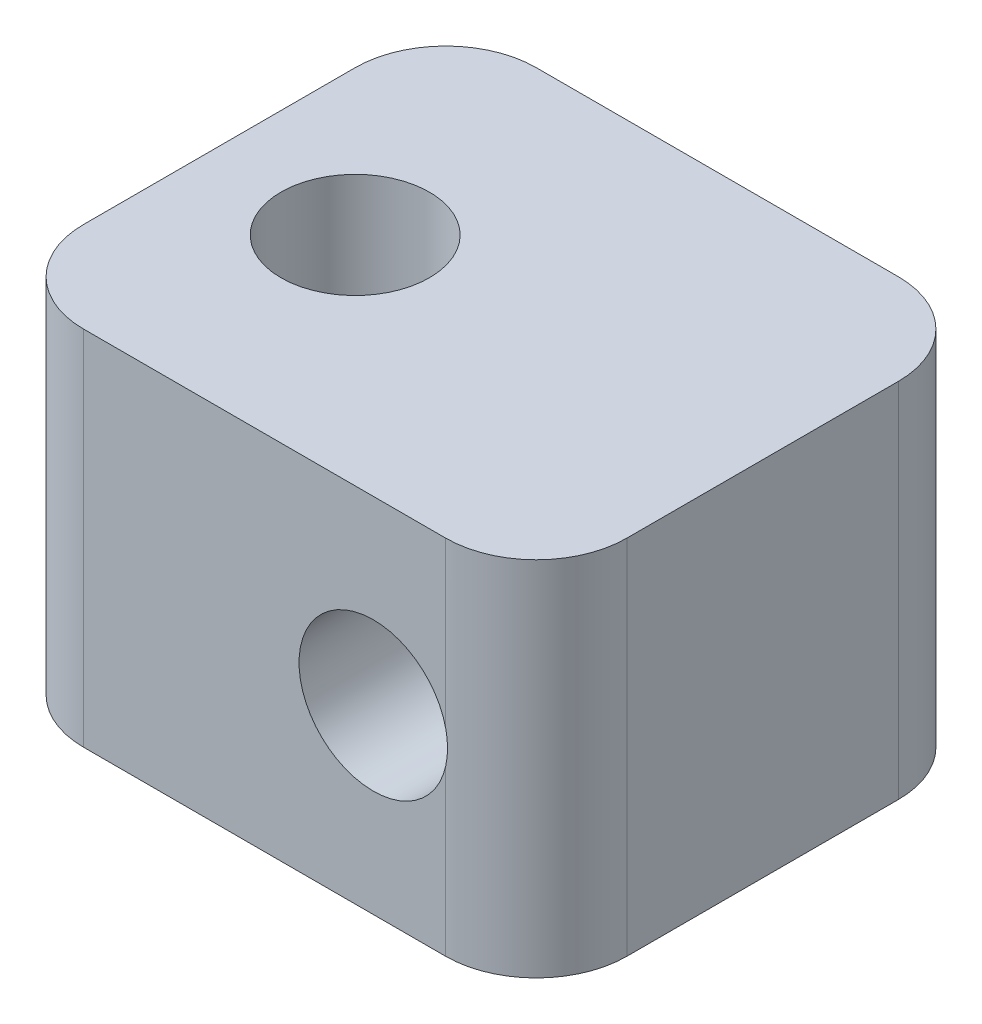
from build123d import *

# Parameters (mm, degrees)
SKETCH_1_W          = 30
SKETCH_1_H          = 20
EXTRUDE_1_DEPTH     = 25
SKETCH_2_R          = 4.1
CUT_EXTRUDE_1_DEPTH = 25
SKETCH_3_R          = 4.1
CUT_EXTRUDE_2_DEPTH = 25
FILLET_2_R          = 5


with BuildPart() as part:
    # 草图1 → 凸台-拉伸1 (new body)
    with BuildSketch(Plane.XY):
        Rectangle(SKETCH_1_W, SKETCH_1_H)
    extrude(amount=EXTRUDE_1_DEPTH)

    # 草图2 → 切除-拉伸1 (cut)
    with BuildSketch(Plane.XY.offset(25)):
        with Locations((6, 0)):
            Circle(SKETCH_2_R)
    extrude(amount=-CUT_EXTRUDE_1_DEPTH, mode=Mode.SUBTRACT)

    # 草图3 → 切除-拉伸2 (cut)
    with BuildSketch(Plane(origin=(0, 10, 0), x_dir=(1, 0, 0), z_dir=(0, 1, 0))):
        with Locations(Location((-7, -13, 0), (0, 0, 270))):
            Circle(SKETCH_3_R)
    extrude(amount=-CUT_EXTRUDE_2_DEPTH, mode=Mode.SUBTRACT)

    # 圆角2
    fillet_2_edges = [part.edges().sort_by_distance(p)[0] for p in [
        (-15, 0, 25),
        (15, 0, 25),
        (-15, 0, 0),
        (15, 0, 0),
    ]]
    fillet(fillet_2_edges, radius=FILLET_2_R)


solid = part.part
